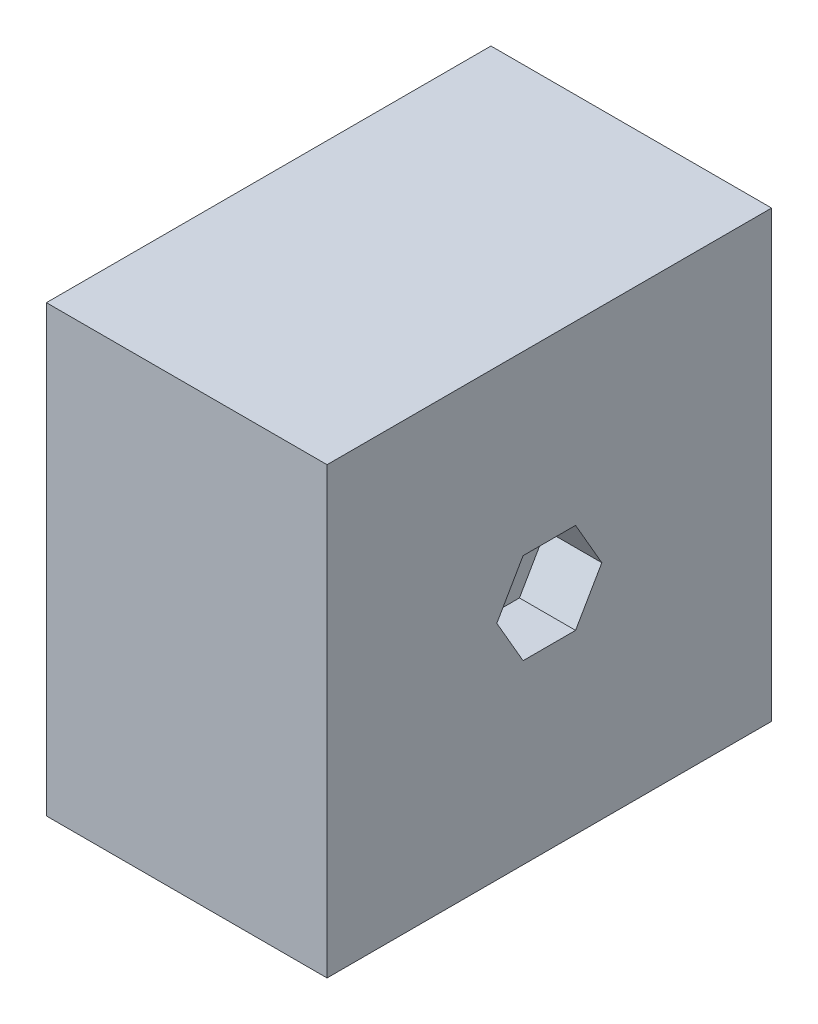
from build123d import *

# Parameters (mm, degrees)
SKETCH1_W               = 39.6
SKETCH1_H               = 39.6
BOSS_EXTRUDE1_DEPTH     = 25
CUT_EXTRUDE1_DEPTH      = 5
CUT_EXTRUDE2_DEPTH      = 38.537714368
CUT_EXTRUDE2_DEPTH_BACK = 38.537714368
SKETCH3_R               = 2.75
CUT_EXTRUDE4_START      = 25
CUT_EXTRUDE4_DEPTH      = 5


with BuildPart() as part:
    # Sketch1 → Boss-Extrude1 (new body)
    with BuildSketch(Plane(origin=(0, 0, 0), x_dir=(0, 0, -1), z_dir=(1, 0, 0))):
        Rectangle(SKETCH1_W, SKETCH1_H)
    extrude(amount=BOSS_EXTRUDE1_DEPTH)

    # Sketch2 → Cut-Extrude1 (cut)
    with BuildSketch(Plane(origin=(0, 0, 0), x_dir=(0, 0, -1), z_dir=(1, 0, 0))):
        Polygon((4.67653718, 0), (2.33826859, 4.05), (-2.33826859, 4.05), (-4.67653718, 0), (-2.33826859, -4.05), (2.33826859, -4.05), align=None)
    extrude(amount=CUT_EXTRUDE1_DEPTH, mode=Mode.SUBTRACT)

    # Sketch3 → Cut-Extrude2 (cut, two sides: drawn at the far end of the back side and taken through both)
    with BuildSketch(Plane(origin=(0, 0, 0), x_dir=(0, 0, -1), z_dir=(1, 0, 0)).offset(-CUT_EXTRUDE2_DEPTH_BACK)):
        Circle(SKETCH3_R)
    extrude(amount=CUT_EXTRUDE2_DEPTH + CUT_EXTRUDE2_DEPTH_BACK, mode=Mode.SUBTRACT)

    # Sketch2<2> → Cut-Extrude4 (cut)
    with BuildSketch(Plane(origin=(0, 0, 0), x_dir=(0, 0, -1), z_dir=(1, 0, 0)).offset(CUT_EXTRUDE4_START)):
        Polygon((4.67653718, 0), (2.33826859, 4.05), (-2.33826859, 4.05), (-4.67653718, 0), (-2.33826859, -4.05), (2.33826859, -4.05), align=None)
    extrude(amount=-CUT_EXTRUDE4_DEPTH, mode=Mode.SUBTRACT)


solid = part.part
